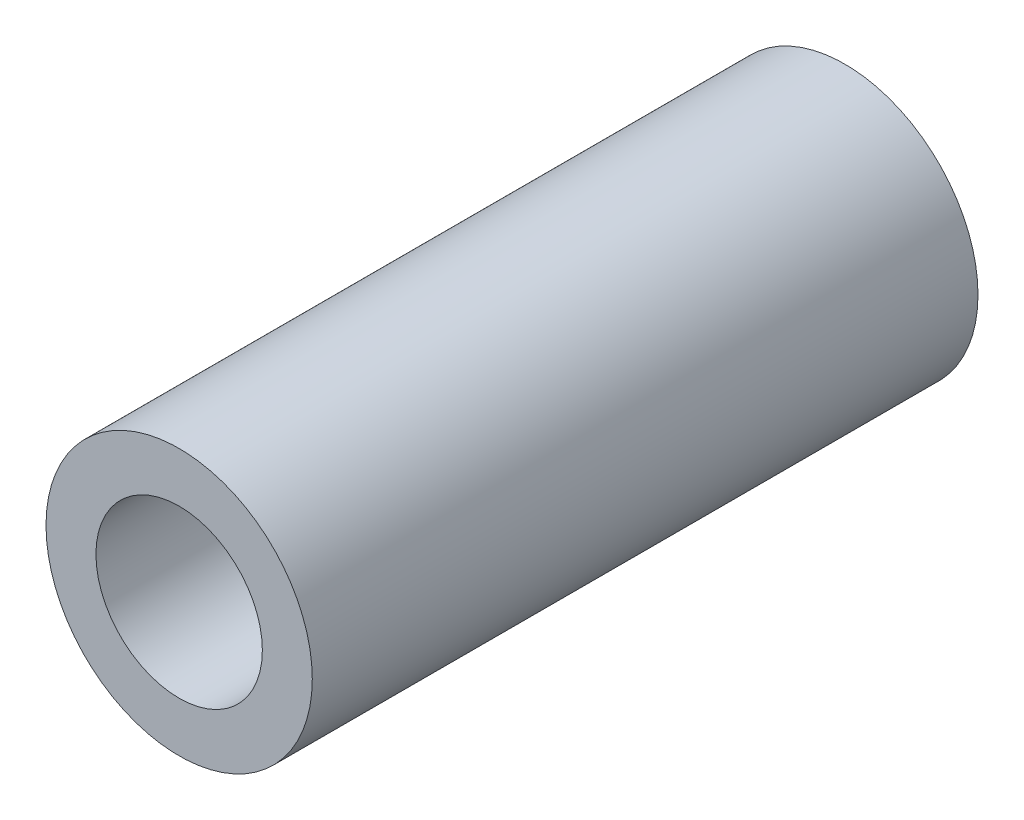
from build123d import *

# Parameters (mm, degrees)
CROQUIS1_R              = 4
CROQUIS1_R_2            = 2.5
SALIENTE_EXTRUIR1_DEPTH = 20


with BuildPart() as part:
    # Croquis1 → Saliente-Extruir1 (new body)
    with BuildSketch(Plane.XY):
        Circle(CROQUIS1_R)
        Circle(CROQUIS1_R_2, mode=Mode.SUBTRACT)
    extrude(amount=SALIENTE_EXTRUIR1_DEPTH)


solid = part.part
